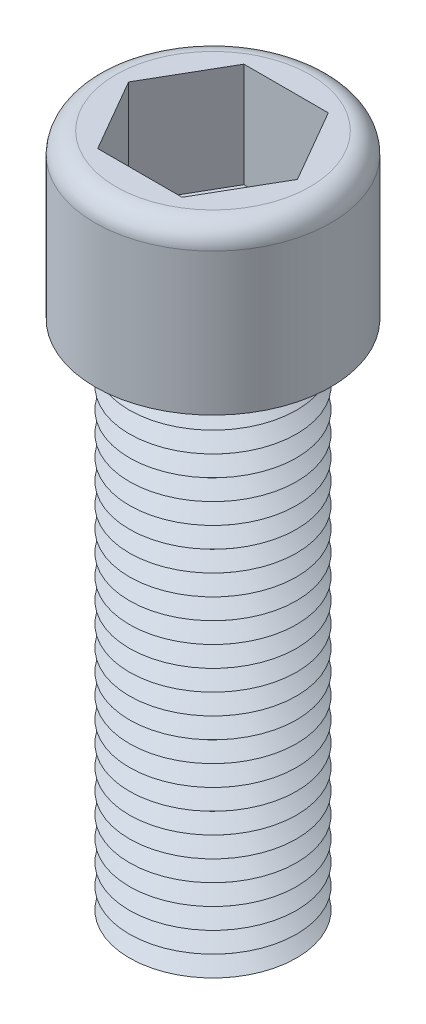
from build123d import *

# Parameters (mm, degrees)
CUT_EXTRUDE_1_DEPTH = 5


with BuildPart() as part:
    # 草图4 → 旋转3 (revolve)
    with BuildSketch(Plane.XY, mode=Mode.PRIVATE) as revolve_3_sk:
        with BuildLine():
            Line((0, 0), (0, 32.8))
            Line((0, 32.8), (4.65, 32.8))
            ThreePointArc((4.65, 32.8), (5.357106781, 32.507106781), (5.65, 31.8))
            Line((5.65, 31.8), (5.65, 25))
            Line((5.65, 25), (3.738374166, 25))
            Line((3.738374166, 25), (3.3, 24.690748957))
            Line((3.3, 24.690748957), (4, 24.196933978))
            Line((4, 24.196933978), (3.3, 23.703118999))
            Line((3.3, 23.703118999), (4, 23.20930402))
            Line((4, 23.20930402), (3.3, 22.715489041))
            Line((3.3, 22.715489041), (4, 22.221674062))
            Line((4, 22.221674062), (3.3, 21.727859083))
            Line((3.3, 21.727859083), (4, 21.234044103))
            Line((4, 21.234044103), (3.3, 20.740229124))
            Line((3.3, 20.740229124), (4, 20.246414145))
            Line((4, 20.246414145), (3.3, 19.752599166))
            Line((3.3, 19.752599166), (4, 19.258784187))
            Line((4, 19.258784187), (3.3, 18.764969208))
            Line((3.3, 18.764969208), (4, 18.271154229))
            Line((4, 18.271154229), (3.3, 17.777339249))
            Line((3.3, 17.777339249), (4, 17.28352427))
            Line((4, 17.28352427), (3.3, 16.789709291))
            Line((3.3, 16.789709291), (4, 16.295894312))
            Line((4, 16.295894312), (3.3, 15.802079333))
            Line((3.3, 15.802079333), (4, 15.308264354))
            Line((4, 15.308264354), (3.3, 14.814449374))
            Line((3.3, 14.814449374), (4, 14.320634395))
            Line((4, 14.320634395), (3.3, 13.826819416))
            Line((3.3, 13.826819416), (4, 13.333004437))
            Line((4, 13.333004437), (3.3, 12.839189458))
            Line((3.3, 12.839189458), (4, 12.345374479))
            Line((4, 12.345374479), (3.3, 11.8515595))
            Line((3.3, 11.8515595), (4, 11.35774452))
            Line((4, 11.35774452), (3.3, 10.863929541))
            Line((3.3, 10.863929541), (4, 10.370114562))
            Line((4, 10.370114562), (3.3, 9.876299583))
            Line((3.3, 9.876299583), (4, 9.382484604))
            Line((4, 9.382484604), (3.3, 8.888669625))
            Line((3.3, 8.888669625), (4, 8.394854646))
            Line((4, 8.394854646), (3.3, 7.901039666))
            Line((3.3, 7.901039666), (4, 7.407224687))
            Line((4, 7.407224687), (3.3, 6.913409708))
            Line((3.3, 6.913409708), (4, 6.419594729))
            Line((4, 6.419594729), (3.3, 5.92577975))
            Line((3.3, 5.92577975), (4, 5.431964771))
            Line((4, 5.431964771), (3.3, 4.938149791))
            Line((3.3, 4.938149791), (4, 4.444334812))
            Line((4, 4.444334812), (3.3, 3.950519833))
            Line((3.3, 3.950519833), (4, 3.456704854))
            Line((4, 3.456704854), (3.3, 2.962889875))
            Line((3.3, 2.962889875), (4, 2.469074896))
            Line((4, 2.469074896), (3.3, 1.975259917))
            Line((3.3, 1.975259917), (4, 1.481444937))
            Line((4, 1.481444937), (3.3, 0.987629958))
            Line((3.3, 0.987629958), (4, 0.493814979))
            Line((4, 0.493814979), (3.3, 0))
            Line((3.3, 0), (0, 0))
        make_face()
    revolve(revolve_3_sk.sketch.rotate(Axis((0, 24.690748957, 0), (0, 1, 0)), 90), axis=Axis((0, 24.690748957, 0), (0, 1, 0)))

    # 草图6 → 切除-拉伸1 (cut)
    with BuildSketch(Plane(origin=(0, 32.8, 0), x_dir=(1, 0, 0), z_dir=(0, 1, 0))):
        Polygon((4.041451884, 0), (2.020725942, 3.5), (-2.020725942, 3.5), (-4.041451884, 0), (-2.020725942, -3.5), (2.020725942, -3.5), align=None)
    extrude(amount=-CUT_EXTRUDE_1_DEPTH, mode=Mode.SUBTRACT)


solid = part.part
